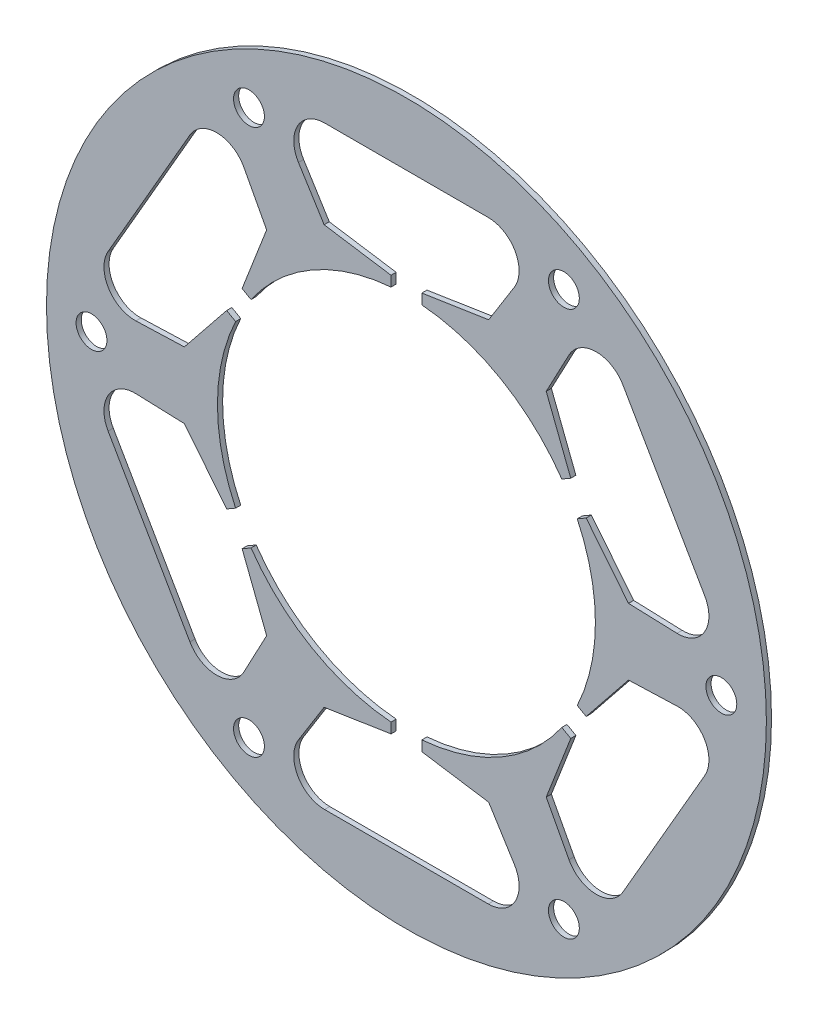
from build123d import *

# Parameters (mm, degrees)
IZIM2_R                     = 35
IZIM2_R_2                   = 1.5
Y_KSEKLIK_EKSTR_ZYON1_DEPTH = 0.5


with BuildPart() as part:
    # Çizim2 → Yükseklik-Ekstrüzyon1 (new body)
    with BuildSketch(Plane.XY):
        Circle(IZIM2_R)
        with Locations((-15.31013221, -26.517926859)):
            Circle(IZIM2_R_2, mode=Mode.SUBTRACT)
        with Locations((30.62026442, 0)):
            Circle(IZIM2_R_2, mode=Mode.SUBTRACT)
        with Locations((-15.31013221, 26.517926859)):
            Circle(IZIM2_R_2, mode=Mode.SUBTRACT)
        with Locations((15.31013221, 26.517926859)):
            Circle(IZIM2_R_2, mode=Mode.SUBTRACT)
        with Locations((15.31013221, -26.517926859)):
            Circle(IZIM2_R_2, mode=Mode.SUBTRACT)
        with Locations((-30.62026442, 0)):
            Circle(IZIM2_R_2, mode=Mode.SUBTRACT)
        with BuildLine():
            Line((-15.110106202, 10.455874691), (-15.976131606, 10.955874691))
            Line((-15.976131606, 10.955874691), (-13.59215701, 17.085039816))
            Line((-13.59215701, 17.085039816), (-15.806258625, 21.250103325))
            ThreePointArc((-15.806258625, 21.250103325), (-18.402735589, 22.841478137), (-21.05330993, 21.341937514))
            Line((-21.05330993, 21.341937514), (-29.009315019, 7.561732477))
            ThreePointArc((-29.009315019, 7.561732477), (-28.982668121, 4.516497451), (-26.306258625, 3.063569846))
            Line((-26.306258625, 3.063569846), (-21.59215701, 3.228633355))
            Line((-21.59215701, 3.228633355), (-17.476131606, 8.35779848))
            Line((-17.476131606, 8.35779848), (-16.610106202, 7.85779848))
            ThreePointArc((-16.610106202, 7.85779848), (-18.375, 0), (-16.610106202, -7.85779848))
            Line((-16.610106202, -7.85779848), (-17.476131606, -8.35779848))
            Line((-17.476131606, -8.35779848), (-21.59215701, -3.228633355))
            Line((-21.59215701, -3.228633355), (-26.306258625, -3.063569846))
            ThreePointArc((-26.306258625, -3.063569846), (-28.982668121, -4.516497451), (-29.009315018, -7.561732476))
            Line((-29.009315018, -7.561732476), (-21.05330993, -21.341937514))
            ThreePointArc((-21.05330993, -21.341937514), (-18.402735589, -22.841478137), (-15.806258625, -21.250103325))
            Line((-15.806258625, -21.250103325), (-13.59215701, -17.085039816))
            Line((-13.59215701, -17.085039816), (-15.976131606, -10.955874691))
            Line((-15.976131606, -10.955874691), (-15.110106202, -10.455874691))
            ThreePointArc((-15.110106202, -10.455874691), (-9.1875, -15.913216795), (-1.5, -18.313673171))
            Line((-1.5, -18.313673171), (-1.5, -19.313673171))
            Line((-1.5, -19.313673171), (-8, -20.313673171))
            Line((-8, -20.313673171), (-10.5, -24.313673171))
            ThreePointArc((-10.5, -24.313673171), (-10.579932532, -27.357975588), (-7.956005088, -28.903669991))
            Line((-7.956005088, -28.903669991), (7.956005088, -28.903669991))
            ThreePointArc((7.956005088, -28.903669991), (10.579932532, -27.357975588), (10.5, -24.313673171))
            Line((10.5, -24.313673171), (8, -20.313673171))
            Line((8, -20.313673171), (1.5, -19.313673171))
            Line((1.5, -19.313673171), (1.5, -18.313673171))
            ThreePointArc((1.5, -18.313673171), (9.1875, -15.913216795), (15.110106202, -10.455874691))
            Line((15.110106202, -10.455874691), (15.976131606, -10.955874691))
            Line((15.976131606, -10.955874691), (13.59215701, -17.085039816))
            Line((13.59215701, -17.085039816), (15.806258625, -21.250103325))
            ThreePointArc((15.806258625, -21.250103325), (18.402735589, -22.841478137), (21.05330993, -21.341937514))
            Line((21.05330993, -21.341937514), (29.009315019, -7.561732476))
            ThreePointArc((29.009315019, -7.561732476), (28.982668121, -4.516497451), (26.306258625, -3.063569846))
            Line((26.306258625, -3.063569846), (21.59215701, -3.228633355))
            Line((21.59215701, -3.228633355), (17.476131606, -8.35779848))
            Line((17.476131606, -8.35779848), (16.610106202, -7.85779848))
            ThreePointArc((16.610106202, -7.85779848), (18.375, 0), (16.610106202, 7.85779848))
            Line((16.610106202, 7.85779848), (17.476131606, 8.35779848))
            Line((17.476131606, 8.35779848), (21.59215701, 3.228633355))
            Line((21.59215701, 3.228633355), (26.306258625, 3.063569846))
            ThreePointArc((26.306258625, 3.063569846), (28.982668121, 4.516497451), (29.009315018, 7.561732476))
            Line((29.009315018, 7.561732476), (21.05330993, 21.341937514))
            ThreePointArc((21.05330993, 21.341937514), (18.402735589, 22.841478137), (15.806258625, 21.250103325))
            Line((15.806258625, 21.250103325), (13.59215701, 17.085039816))
            Line((13.59215701, 17.085039816), (15.976131606, 10.955874691))
            Line((15.976131606, 10.955874691), (15.110106202, 10.455874691))
            ThreePointArc((15.110106202, 10.455874691), (9.1875, 15.913216795), (1.5, 18.313673171))
            Line((1.5, 18.313673171), (1.5, 19.313673171))
            Line((1.5, 19.313673171), (8, 20.313673171))
            Line((8, 20.313673171), (10.5, 24.313673171))
            ThreePointArc((10.5, 24.313673171), (10.579932532, 27.357975588), (7.956005088, 28.903669991))
            Line((7.956005088, 28.903669991), (-7.956005088, 28.903669991))
            ThreePointArc((-7.956005088, 28.903669991), (-10.579932532, 27.357975588), (-10.5, 24.313673171))
            Line((-10.5, 24.313673171), (-8, 20.313673171))
            Line((-8, 20.313673171), (-1.5, 19.313673171))
            Line((-1.5, 19.313673171), (-1.5, 18.313673171))
            ThreePointArc((-1.5, 18.313673171), (-9.1875, 15.913216795), (-15.110106202, 10.455874691))
        make_face(mode=Mode.SUBTRACT)
    extrude(amount=Y_KSEKLIK_EKSTR_ZYON1_DEPTH)


solid = part.part
